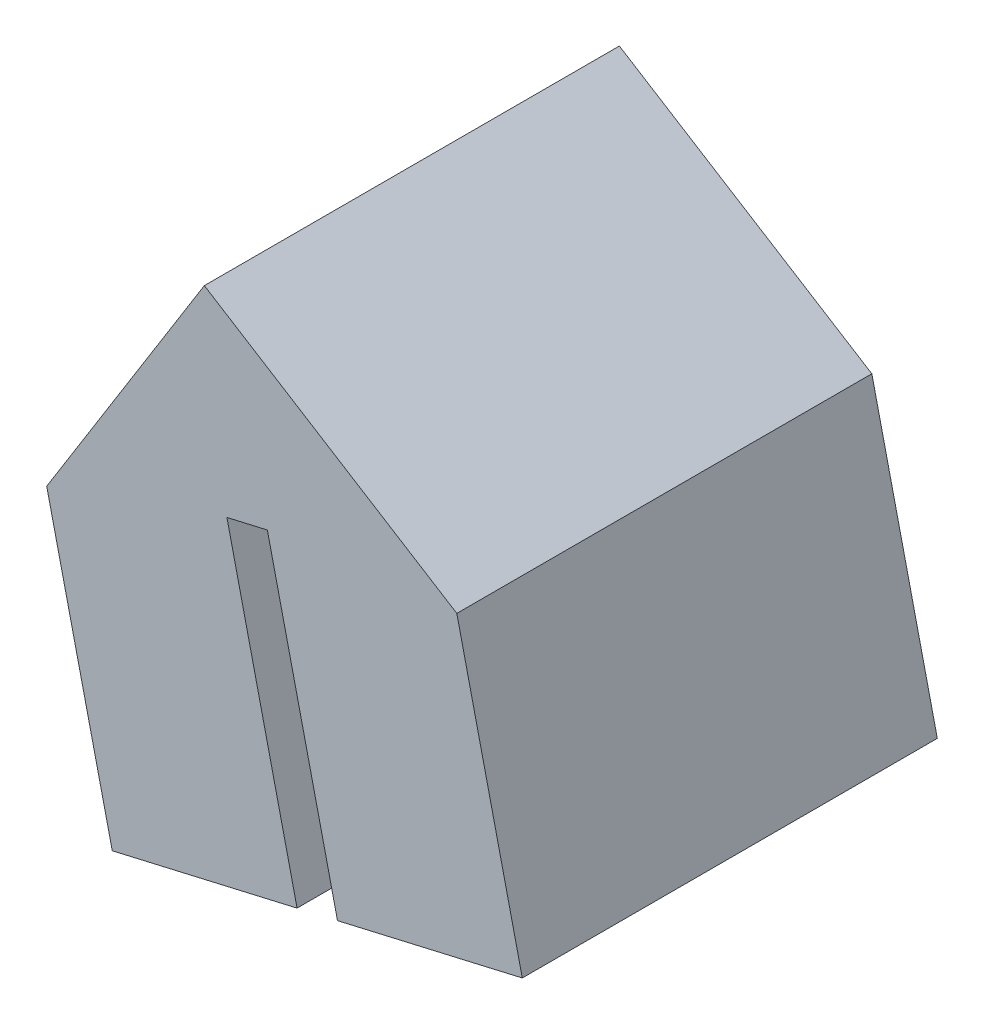
from build123d import *

# Parameters (mm, degrees)
BOSS_EXTRU_1_DEPTH      = 20
ENL_V_MAT_EXTRU_1_DEPTH = 20
ENL_V_MAT_EXTRU_2_DEPTH = 20


with BuildPart() as part:
    # Esquisse1 → Boss.-Extru.1 (new body)
    with BuildSketch(Plane.XY):
        Polygon((0, 0), (10.591231248, 16.965430164), (27.556661412, 6.374198916), (29.810281051, -3.368552159), (2.257780804, -9.74178761), align=None)
    extrude(amount=BOSS_EXTRU_1_DEPTH)

    # Esquisse3 → Enlèv. mat.-Extru.1 (cut)
    with BuildSketch(Plane.XY.offset(20)):
        Polygon((15.059755827, -6.780531881), (17.008306042, -6.329807952), (13.627876577, 8.28431866), (11.679326362, 7.833594731), align=None)
    extrude(amount=-ENL_V_MAT_EXTRU_1_DEPTH, mode=Mode.SUBTRACT)

    # Esquisse4 → Enlèv. mat.-Extru.2 (cut)
    with BuildSketch(Plane.XY.offset(20)):
        Polygon((6.154881268, -8.8403399), (2.994373603, 4.796499582), (-5.37239396, 2.5559716), (0.883083606, -10.672172042), (6.394810123, -10.300296517), align=None)
        Polygon((25.913180592, -4.269999889), (22.758113126, 9.369851491), (37.693290305, 8.113830617), (39.464159746, -8.899165087), (30.389447251, -4.288402222), align=None)
    extrude(amount=-ENL_V_MAT_EXTRU_2_DEPTH, mode=Mode.SUBTRACT)


solid = part.part
